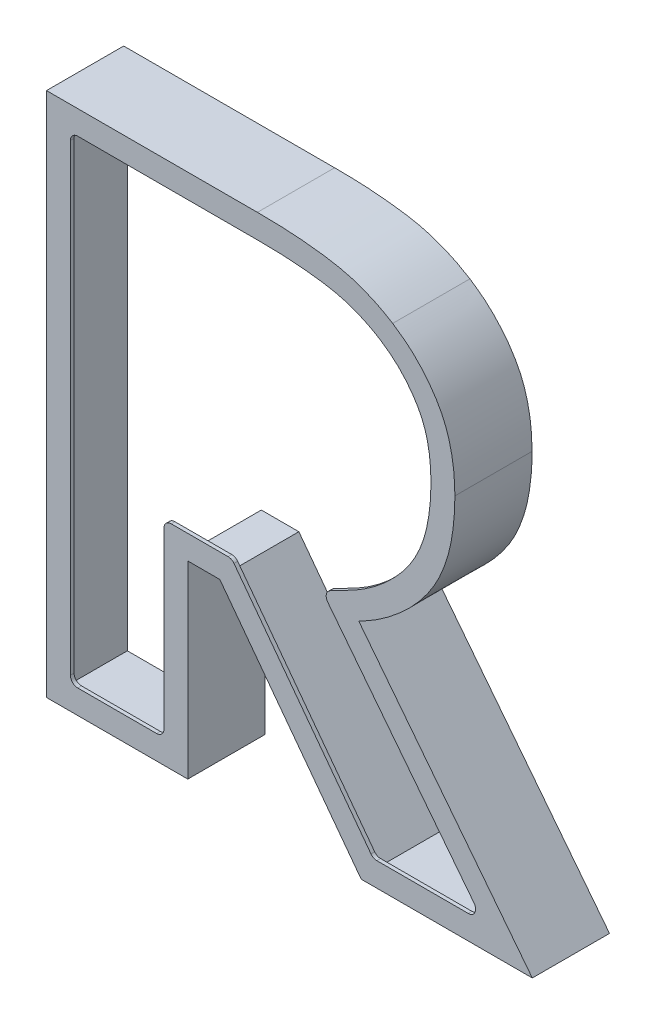
from build123d import *

# Parameters (mm, degrees)
BOSS_EXTRUDE1_DEPTH      = 1
BOSS_EXTRUDE1_DEPTH_BACK = 20
CUT_EXTRUDE1_DEPTH       = 187.724280442
CUT_EXTRUDE2_DEPTH       = 20
FILLET1_R                = 2


with BuildPart() as part:
    # Sketch1 → Boss-Extrude1 (new, two sides: drawn at the far end of the back side and taken through both)
    with BuildSketch(Plane.XY.offset(-BOSS_EXTRUDE1_DEPTH_BACK)):
        with BuildLine():
            Line((2984.2848084, -1502.582577839), (2926.906643843, -1502.582577839))
            Line((2926.906643843, -1502.582577839), (2926.906643843, -1645.582577839))
            Line((2926.906643843, -1645.582577839), (2965.349681818, -1645.582577839))
            Line((2965.349681818, -1645.582577839), (2965.349681818, -1594.190172775))
            Line((2965.349681818, -1594.190172775), (2974.06390086, -1594.190172775))
            Line((2974.06390086, -1594.190172775), (3012.525135037, -1645.582577839))
            Line((3012.525135037, -1645.582577839), (3059.075680802, -1645.582577839))
            Line((3059.075680802, -1645.582577839), (3011.858859874, -1585.104503091))
            add(Edge.make_bspline(
                [(3011.858859874, -1585.104503091), (3012.83998938, -1584.590602688), (3013.81441284, -1584.067213423), (3015.726766863, -1582.968798491), (3016.663026814, -1582.391408957), (3018.487981846, -1581.169326966), (3019.378431852, -1580.527117675), (3021.120719382, -1579.188063543), (3021.973120656, -1578.49201639), (3023.223781268, -1577.408409525), (3023.635859205, -1577.040402734), (3024.449763482, -1576.289883437), (3024.852228207, -1575.90672254), (3026.036588204, -1574.740662431), (3026.796146495, -1573.940310237), (3028.253085243, -1572.292004006), (3028.95069718, -1571.444227184), (3030.282437238, -1569.700071869), (3030.917790974, -1568.804631677), (3032.113171176, -1566.956082559), (3032.671014476, -1566.001302254), (3033.697843419, -1564.023714375), (3034.157481059, -1563.016568951), (3034.988918703, -1560.976524047), (3035.36479999, -1559.944101398), (3036.040132597, -1557.855465805), (3036.337246922, -1556.798525426), (3036.846577294, -1554.658218451), (3037.057054667, -1553.574310658), (3037.318609397, -1551.931590215), (3037.397426256, -1551.381034382), (3037.542630099, -1550.280021758), (3037.609796894, -1549.729127431), (3037.790841286, -1548.074984095), (3037.881513082, -1546.970078421), (3037.979913573, -1544.754345752), (3037.994015006, -1543.643973708), (3038.00816144, -1542.533604877)],
                knots=[0, 0, 0, 0, 0.0625, 0.0625, 0.125, 0.125, 0.1875, 0.1875, 0.25, 0.25, 0.28125, 0.28125, 0.3125, 0.3125, 0.375, 0.375, 0.4375, 0.4375, 0.5, 0.5, 0.5625, 0.5625, 0.625, 0.625, 0.6875, 0.6875, 0.75, 0.75, 0.8125, 0.8125, 0.84375, 0.84375, 0.875, 0.875, 0.9375, 0.9375, 1, 1, 1, 1], degree=3))
            add(Edge.make_bspline(
                [(3038.00816144, -1542.533604877), (3037.966209329, -1540.941659626), (3037.923834485, -1539.349780184), (3037.668736122, -1536.192540799), (3037.446890521, -1534.62860096), (3036.978688082, -1532.303775266), (3036.801406838, -1531.532135879), (3036.39929486, -1529.996259503), (3036.173449095, -1529.232180531), (3035.785700137, -1528.093687217), (3035.64800419, -1527.714916773), (3035.357445158, -1526.968549531), (3035.204160272, -1526.600103759), (3034.722173523, -1525.507864961), (3034.37149332, -1524.79707946), (3033.245857357, -1522.708279171), (3032.40199353, -1521.371046505), (3031.003656969, -1519.44363964), (3030.514725294, -1518.81467603), (3029.492468944, -1517.583022083), (3028.962289747, -1516.983959153), (3027.329094281, -1515.242409324), (3026.183185576, -1514.146705109), (3023.726345397, -1512.144063035), (3022.407788705, -1511.245847517), (3021.088238873, -1510.348768033)],
                knots=[0, 0, 0, 0, 0.125, 0.125, 0.25, 0.25, 0.3125, 0.3125, 0.375, 0.375, 0.40625, 0.40625, 0.4375, 0.4375, 0.5, 0.5, 0.625, 0.625, 0.6875, 0.6875, 0.75, 0.75, 0.875, 0.875, 1, 1, 1, 1], degree=3))
            add(Edge.make_bspline(
                [(3021.088238873, -1510.348768033), (3019.720260062, -1509.532736106), (3018.351689722, -1508.717908526), (3015.508511845, -1507.30414423), (3014.039791775, -1506.693220678), (3011.791014539, -1505.869874339), (3011.036561679, -1505.614120044), (3009.517268846, -1505.14745295), (3008.752021466, -1504.937468002), (3006.439644212, -1504.376859547), (3004.877251028, -1504.089863832), (3001.729768134, -1503.610486851), (3000.148216407, -1503.418432605), (2996.98594968, -1503.086517836), (2995.40284905, -1502.951678916), (2992.23242275, -1502.748833316), (2990.64509818, -1502.680809232), (2987.466661113, -1502.604678978), (2985.87573557, -1502.593615534), (2984.2848084, -1502.582577839)],
                knots=[0, 0, 0, 0, 0.125, 0.125, 0.25, 0.25, 0.3125, 0.3125, 0.375, 0.375, 0.5, 0.5, 0.625, 0.625, 0.75, 0.75, 0.875, 0.875, 1, 1, 1, 1], degree=3))
        make_face()
    extrude(amount=BOSS_EXTRUDE1_DEPTH + BOSS_EXTRUDE1_DEPTH_BACK)

    # 3DSketch1 → Cut-Extrude1 (cut, through all)
    with BuildSketch(Plane(origin=(2933.406643843, -1639.082577839, -20), x_dir=(0.5744095423960195, 0.8185680653460625, 0), z_dir=(0, 0, -1))):
        with BuildLine():
            Line((0, 0), (106.413848495, -74.673240511))
            Line((106.413848495, -74.673240511), (135.625799875, -33.04445693))
            add(Edge.make_bspline(
                [(135.625799875, -33.04445693), (135.799951481, -32.792581737), (135.974100118, -32.540704451), (136.148178552, -32.288777712), (136.669282627, -31.533748705), (137.188549778, -30.7774257), (137.532895426, -30.272470667), (138.389890916, -29.003027788), (139.227101348, -27.720309304), (139.722814843, -26.944617597), (140.687324237, -25.401967412), (141.620726391, -23.84021623), (142.073993877, -23.064035557), (142.929585633, -21.563318779), (143.754250337, -20.045575089), (144.142229527, -19.313374795), (144.85505821, -17.931217533), (145.537499051, -16.533099803), (145.846375821, -15.875355826), (146.412560685, -14.604786726), (146.918444456, -13.30850922), (147.1461163, -12.683831346), (147.560243161, -11.462122078), (147.919822079, -10.223523373), (148.081588863, -9.619695702), (148.390790516, -8.365013211), (148.64926674, -7.098629925), (148.76755286, -6.442027582), (148.936004779, -5.348111255), (149.053768151, -4.247781829), (149.09456253, -3.809816009), (149.148961127, -3.161669567), (149.198978015, -2.513392027), (149.214838589, -2.303536679), (149.230498794, -2.093675335), (149.246088003, -1.883811868)],
                knots=[0, 0, 0, 0, 0, 0, 0.044396025, 0.044396025, 0.044396025, 0.133004579, 0.133004579, 0.133004579, 0.266451549, 0.266451549, 0.266451549, 0.396744241, 0.396744241, 0.396744241, 0.516874936, 0.516874936, 0.516874936, 0.622179725, 0.622179725, 0.622179725, 0.718504074, 0.718504074, 0.718504074, 0.809085422, 0.809085422, 0.809085422, 0.905745281, 0.905745281, 0.905745281, 0.969490032, 0.969490032, 0.969490032, 1, 1, 1, 1, 1, 1], degree=5))
            add(Edge.make_bspline(
                [(149.246088003, -1.883811868), (149.248442123, -1.723619003), (149.250755383, -1.563424748), (149.2529711, -1.403227188), (149.259676586, -0.882129324), (149.264150565, -0.360955844), (149.264795452, 0), (149.256829104, 0.900780996), (149.21634892, 1.801267083), (149.17953731, 2.340270897), (149.072946172, 3.481323674), (148.901983232, 4.614361307), (148.795535796, 5.21098326), (148.535216547, 6.493514726), (148.218061969, 7.763208259), (148.030334043, 8.440168662), (147.597886077, 9.847566247), (147.079050554, 11.226304979), (146.783386678, 11.937916262), (146.143197722, 13.336487925), (145.400428482, 14.684920936), (145.003600939, 15.342809042), (144.201427947, 16.555375267), (143.301185882, 17.695567097), (142.858210052, 18.219529274), (141.989984663, 19.191089869), (141.083629027, 20.125615514), (140.645523321, 20.558552934), (139.790876749, 21.364856228), (138.898539583, 22.129357305), (138.466781804, 22.485134699), (137.730747876, 23.07264277), (136.983399264, 23.64488851), (136.678619933, 23.875262261), (136.229067803, 24.212065337), (135.778373548, 24.547356273), (135.634126325, 24.654496933), (135.489830496, 24.761573241), (135.345520189, 24.868630382)],
                knots=[0, 0, 0, 0, 0, 0, 0.025326461, 0.025326461, 0.025326461, 0.082380369, 0.082380369, 0.082380369, 0.167714652, 0.167714652, 0.167714652, 0.263440714, 0.263440714, 0.263440714, 0.374387407, 0.374387407, 0.374387407, 0.496015783, 0.496015783, 0.496015783, 0.617184224, 0.617184224, 0.617184224, 0.725487873, 0.725487873, 0.725487873, 0.82280401, 0.82280401, 0.82280401, 0.911198334, 0.911198334, 0.911198334, 0.97159483, 0.97159483, 0.97159483, 1, 1, 1, 1, 1, 1], degree=5))
            add(Edge.make_bspline(
                [(135.345520189, 24.868630382), (135.19451331, 24.971741545), (135.043491833, 25.074832659), (134.892420469, 25.177855841), (134.408967725, 25.506990427), (133.924284319, 25.834449196), (133.589849912, 26.057574983), (132.748870463, 26.607545836), (131.890933739, 27.13086466), (131.371026757, 27.436372607), (130.340304316, 28.022713957), (129.296560956, 28.585165546), (128.780199983, 28.855043005), (127.580342615, 29.460850008), (126.359252145, 30.023765863), (125.660297227, 30.32685787), (124.098766719, 30.957283246), (122.499230238, 31.490165832), (121.613379094, 31.75212007), (119.644264047, 32.261817866), (117.641378576, 32.620838716), (116.540735955, 32.769679448), (114.318477817, 32.969677054), (112.087967444, 32.961131425), (110.967197312, 32.909442306), (108.832201617, 32.73034016), (106.715446347, 32.416977395), (105.712088509, 32.238728953), (103.83699449, 31.852025892), (101.983743989, 31.373223412), (101.122262799, 31.128738729), (99.52140949, 30.632127101), (97.945278963, 30.061463135), (97.217143999, 29.779416539), (96.014390726, 29.281871558), (94.832003032, 28.738276709), (94.361835692, 28.514318331), (93.652265046, 28.166038533), (92.948228125, 27.807262363), (92.708453976, 27.684040427), (91.083930507, 26.845674146), (89.459407038, 26.007307864), (88.074443001, 25.292570791), (86.689478965, 24.577833718), (85.304514929, 23.863096645)],
                knots=[0, 0, 0, 0, 0, 0, 0.017053395, 0.017053395, 0.017053395, 0.054542893, 0.054542893, 0.054542893, 0.110764409, 0.110764409, 0.110764409, 0.165092797, 0.165092797, 0.165092797, 0.236106173, 0.236106173, 0.236106173, 0.322068523, 0.322068523, 0.322068523, 0.425383711, 0.425383711, 0.425383711, 0.529777789, 0.529777789, 0.529777789, 0.624717393, 0.624717393, 0.624717393, 0.708181226, 0.708181226, 0.708181226, 0.78095669, 0.78095669, 0.78095669, 0.829505636, 0.829505636, 0.829505636, 0.85464749, 0.85464749, 0.85464749, 1, 1, 1, 1, 1, 1], degree=5))
            Line((85.304514929, 23.863096645), (64.533726436, 91.964432516))
            Line((64.533726436, 91.964432516), (47.315663839, 67.427660146))
            Line((47.315663839, 67.427660146), (67.291345502, 6.42423422))
            Line((67.291345502, 6.42423422), (56.682905386, -8.693429504))
            Line((56.682905386, -8.693429504), (14.6147238, 20.826858371))
            Line((14.6147238, 20.826858371), (0, 0))
        make_face()
    extrude(amount=-CUT_EXTRUDE1_DEPTH, mode=Mode.SUBTRACT)

    # 3DSketch2 → Cut-Extrude2 (cut)
    with BuildSketch(Plane(origin=(2927.906643843, -1644.582577839, -20), x_dir=(0.5870171481173537, 0.8095744980026044, 0), z_dir=(0, 0, -1))):
        with BuildLine():
            Line((0, 0), (114.150004218, -82.769417885))
            Line((114.150004218, -82.769417885), (147.242917283, -37.129901956))
            add(Edge.make_bspline(
                [(147.242917283, -37.129901956), (147.426791963, -36.872576515), (147.610666156, -36.615250721), (147.794465981, -36.357870898), (148.345138132, -35.585804496), (148.893813143, -34.812287165), (149.257840699, -34.295569113), (150.166581303, -32.992695137), (151.055038073, -31.675753037), (151.582361371, -30.877706028), (152.61523915, -29.280639856), (153.61595591, -27.663166585), (154.105215801, -26.854131093), (155.036187741, -25.278088587), (155.934728093, -23.683473105), (156.360963684, -22.907869206), (157.156015839, -21.421237224), (157.916694695, -19.916034567), (158.267037132, -19.19567129), (158.919007624, -17.785665787), (159.505299162, -16.346540005), (159.773710773, -15.643045329), (160.26914714, -14.251848774), (160.702898241, -12.840508733), (160.900988028, -12.144329208), (161.275720603, -10.717463863), (161.592575566, -9.276320507), (161.737301298, -8.538845389), (161.946762426, -7.311647534), (162.101403892, -6.076608549), (162.156045501, -5.58603843), (162.232438687, -4.834401334), (162.302308792, -4.082376152), (162.326000081, -3.82166457), (162.349418544, -3.560936757), (162.372819667, -3.300207912)],
                knots=[0, 0, 0, 0, 0, 0, 0.042069933, 0.042069933, 0.042069933, 0.12614507, 0.12614507, 0.12614507, 0.253365353, 0.253365353, 0.253365353, 0.379111028, 0.379111028, 0.379111028, 0.496824564, 0.496824564, 0.496824564, 0.603332568, 0.603332568, 0.603332568, 0.703418003, 0.703418003, 0.703418003, 0.799646851, 0.799646851, 0.799646851, 0.899545254, 0.899545254, 0.899545254, 0.965178615, 0.965178615, 0.965178615, 1, 1, 1, 1, 1, 1], degree=5))
            add(Edge.make_bspline(
                [(162.372819667, -3.300207912), (162.379110622, -3.092654545), (162.385390293, -2.885100581), (162.391526781, -2.677540088), (162.40897416, -2.059667006), (162.422815509, -1.441629471), (162.428974967, -1.031167238), (162.433209577, 0), (162.400116403, 1.031255051), (162.366006269, 1.651433981), (162.260422559, 2.986220847), (162.082660715, 4.313104003), (161.968490278, 5.022043513), (161.686058704, 6.542970695), (161.333799829, 8.049448634), (161.123977484, 8.851303803), (160.632793681, 10.535717361), (160.037488282, 12.187041395), (159.693719147, 13.04743514), (158.946262757, 14.741255746), (158.075427591, 16.376805622), (157.60904967, 17.17654263), (156.667379602, 18.649939382), (155.610148319, 20.041015615), (155.090568752, 20.679649237), (154.084585085, 21.847782019), (153.030130544, 22.970728988), (152.52785051, 23.482972291), (151.567929087, 24.41748936), (150.565660559, 25.306483452), (150.092224528, 25.710929387), (149.291460935, 26.37360149), (148.477167024, 27.018819273), (148.1490311, 27.275345619), (147.65335471, 27.659217903), (147.156189526, 28.041158167), (146.989199488, 28.169212822), (146.822151498, 28.297192272), (146.655100449, 28.425167752)],
                knots=[0, 0, 0, 0, 0, 0, 0.027979876, 0.027979876, 0.027979876, 0.083286405, 0.083286405, 0.083286405, 0.166910157, 0.166910157, 0.166910157, 0.263592966, 0.263592966, 0.263592966, 0.375161553, 0.375161553, 0.375161553, 0.499815934, 0.499815934, 0.499815934, 0.624268973, 0.624268973, 0.624268973, 0.73504659, 0.73504659, 0.73504659, 0.831661034, 0.831661034, 0.831661034, 0.91552222, 0.91552222, 0.91552222, 0.971644404, 0.971644404, 0.971644404, 1, 1, 1, 1, 1, 1], degree=5))
            add(Edge.make_bspline(
                [(146.655100449, 28.425167752), (146.478672306, 28.549696266), (146.302240882, 28.674220187), (146.125744092, 28.798656304), (145.591480789, 29.174540596), (145.055484851, 29.548097478), (144.695187919, 29.795972895), (143.788782968, 30.40741626), (142.8639919, 30.990904223), (142.303400755, 31.332095068), (141.176342751, 31.996781015), (140.034300246, 32.634984682), (139.461058811, 32.945680576), (138.118629488, 33.648727399), (136.751171998, 34.302976264), (135.963659319, 34.657841723), (134.176858453, 35.409459498), (132.34506415, 36.050221396), (131.317389603, 36.37072188), (129.035250603, 36.997469839), (126.711273293, 37.449788275), (125.43499692, 37.642155311), (122.865673677, 37.914157891), (120.283155602, 37.949583598), (118.989317554, 37.913191784), (116.546795396, 37.75183191), (114.122366026, 37.434067691), (112.984833006, 37.251177534), (110.863540674, 36.849187778), (108.765612036, 36.341779324), (107.792899906, 36.081809041), (105.996387766, 35.554390183), (104.226150379, 34.94412537), (103.414027592, 34.644156854), (102.072669013, 34.114507597), (100.752498293, 33.534671033), (100.2279472, 33.295718464), (99.442136396, 32.926200961), (98.662585668, 32.54428221), (98.400935529, 32.414928237), (97.924772623, 32.178460189), (97.448609718, 31.941992141), (97.233861026, 31.835345438), (97.019112334, 31.728698735), (96.804363642, 31.622052033)],
                knots=[0, 0, 0, 0, 0, 0, 0.020358456, 0.020358456, 0.020358456, 0.061581475, 0.061581475, 0.061581475, 0.123428954, 0.123428954, 0.123428954, 0.184886497, 0.184886497, 0.184886497, 0.266272734, 0.266272734, 0.266272734, 0.367535693, 0.367535693, 0.367535693, 0.488896851, 0.488896851, 0.488896851, 0.610645698, 0.610645698, 0.610645698, 0.719139585, 0.719139585, 0.719139585, 0.813999055, 0.813999055, 0.813999055, 0.895562368, 0.895562368, 0.895562368, 0.949879457, 0.949879457, 0.949879457, 0.977395717, 0.977395717, 0.977395717, 1, 1, 1, 1, 1, 1], degree=5))
            Line((96.804363642, 31.622052033), (75.795440956, 104.531965138))
            Line((75.795440956, 104.531965138), (49.966393882, 68.910283753))
            Line((49.966393882, 68.910283753), (68.994970413, 7.604826346))
            Line((68.994970413, 7.604826346), (62.998668751, -0.664868881))
            Line((62.998668751, -0.664868881), (21.392688221, 29.503354174))
            Line((21.392688221, 29.503354174), (0, 0))
        make_face()
    extrude(amount=-CUT_EXTRUDE2_DEPTH, mode=Mode.SUBTRACT)

    # Fillet1
    fillet1_edges = [part.edges().sort_by_distance(p)[0] for p in [
        (2958.849681818, -1639.082577839, 0.5),
        (2933.406643843, -1639.082577839, 0.5),
        (2933.406643843, -1509.082577839, 0.5),
        (3001.939940081, -1582.962216512, 0.5),
        (3045.75457972, -1639.082577839, 0.5),
        (3015.779341974, -1639.082577839, 0.5),
        (2977.318107797, -1587.690172775, 0.5),
        (2958.849681818, -1587.690172775, 0.5),
    ]]
    fillet(fillet1_edges, radius=FILLET1_R)


solid = part.part
